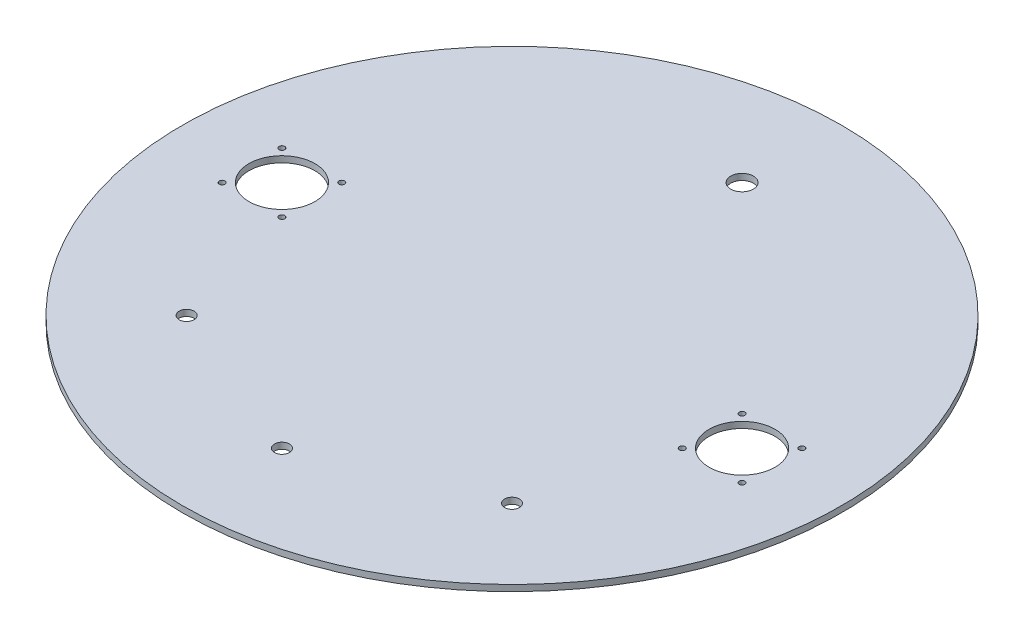
from build123d import *

# Parameters (mm, degrees)
SKETCH1_R           = 265
SKETCH1_R_2         = 26.5
SKETCH1_R_3         = 2.3
SKETCH1_R_4         = 9.1
SKETCH1_R_5         = 6
BOSS_EXTRUDE1_DEPTH = 2.5


with BuildPart() as part:
    # Sketch1 → Boss-Extrude1 (new, symmetric)
    with BuildSketch(Plane(origin=(0, 0, 0), x_dir=(1, 0, 0), z_dir=(0, 1, 0))):
        with Locations(Location((0, 0, 0), (0, 0, 270))):
            Circle(SKETCH1_R)
        with Locations(Location((-185, 0, 0), (0, 0, 270))):
            Circle(SKETCH1_R_2, mode=Mode.SUBTRACT)
        with Locations(Location((185, 0, 0), (0, 0, 270))):
            Circle(SKETCH1_R_2, mode=Mode.SUBTRACT)
        with Locations(Location((-209.05, 24.05, 0), (0, 0, 270))):
            Circle(SKETCH1_R_3, mode=Mode.SUBTRACT)
        with Locations(Location((-160.95, 24.05, 0), (0, 0, 270))):
            Circle(SKETCH1_R_3, mode=Mode.SUBTRACT)
        with Locations(Location((-160.95, -24.05, 0), (0, 0, 270))):
            Circle(SKETCH1_R_3, mode=Mode.SUBTRACT)
        with Locations(Location((-209.05, -24.05, 0), (0, 0, 270))):
            Circle(SKETCH1_R_3, mode=Mode.SUBTRACT)
        with Locations(Location((209.05, -24.05, 0), (0, 0, 270))):
            Circle(SKETCH1_R_3, mode=Mode.SUBTRACT)
        with Locations(Location((160.95, -24.05, 0), (0, 0, 270))):
            Circle(SKETCH1_R_3, mode=Mode.SUBTRACT)
        with Locations(Location((160.95, 24.05, 0), (0, 0, 270))):
            Circle(SKETCH1_R_3, mode=Mode.SUBTRACT)
        with Locations(Location((209.05, 24.05, 0), (0, 0, 270))):
            Circle(SKETCH1_R_3, mode=Mode.SUBTRACT)
        with Locations(Location((0, 185, 0), (0, 0, 270))):
            Circle(SKETCH1_R_4, mode=Mode.SUBTRACT)
        with Locations(Location((-130.81475452, -130.81475452, 0), (0, 0, 270))):
            Circle(SKETCH1_R_5, mode=Mode.SUBTRACT)
        with Locations(Location((130.81475452, -130.81475452, 0), (0, 0, 270))):
            Circle(SKETCH1_R_5, mode=Mode.SUBTRACT)
        with Locations(Location((0, -185, 0), (0, 0, 270))):
            Circle(SKETCH1_R_5, mode=Mode.SUBTRACT)
    extrude(amount=BOSS_EXTRUDE1_DEPTH, both=True)


solid = part.part
